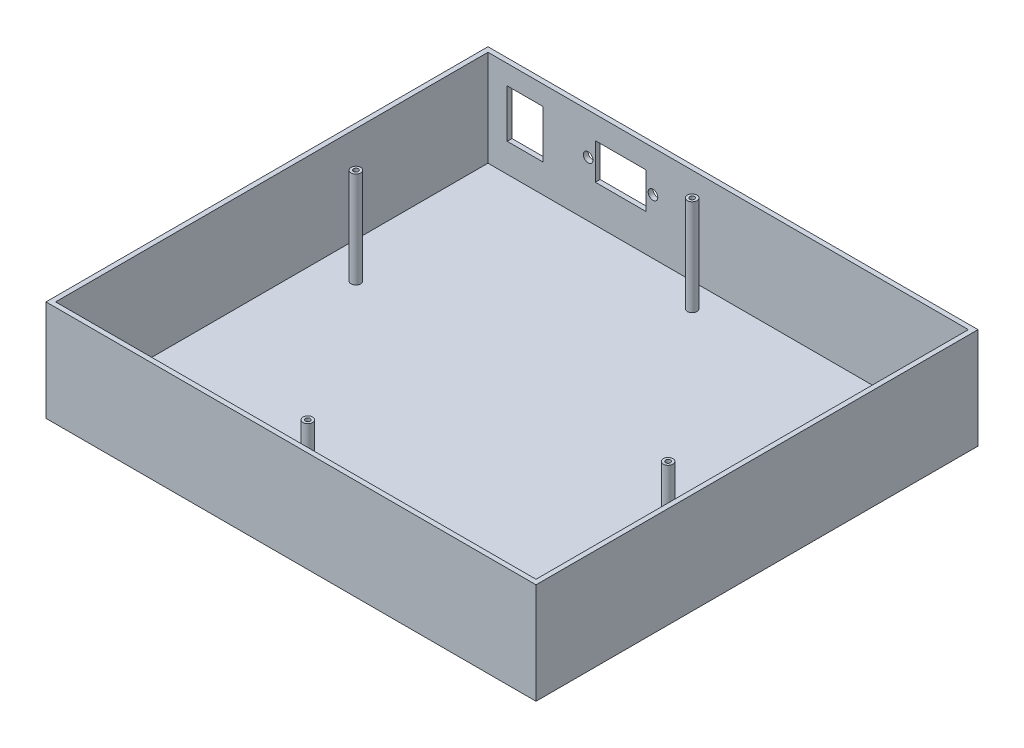
from build123d import *

# Parameters (mm, degrees)
SKETCH4_W           = 200
SKETCH4_H           = 180
BOSS_EXTRUDE3_DEPTH = 2
SKETCH4_3_W         = 204
SKETCH4_3_H         = 184
SKETCH4_3_W_2       = 200
SKETCH4_3_H_2       = 180
BOSS_EXTRUDE4_DEPTH = 42
SKETCH6_R           = 2
BOSS_EXTRUDE5_DEPTH = 40
SKETCH8_R           = 1
CUT_EXTRUDE1_DEPTH  = 40
SKETCH5_R           = 2
SKETCH5_W           = 15
SKETCH5_H           = 20
SKETCH5_W_2         = 21
SKETCH5_H_2         = 15
CUT_EXTRUDE2_DEPTH  = 2


with BuildPart() as part:
    # Sketch4 → Boss-Extrude3 (new body)
    with BuildSketch(Plane(origin=(0, 0, 0), x_dir=(1, 0, 0), z_dir=(0, 1, 0))):
        Rectangle(SKETCH4_W, SKETCH4_H)
    extrude(amount=BOSS_EXTRUDE3_DEPTH)

    # Sketch4<3> → Boss-Extrude4 (add)
    with BuildSketch(Plane(origin=(0, 0, 0), x_dir=(1, 0, 0), z_dir=(0, 1, 0))):
        Rectangle(SKETCH4_3_W, SKETCH4_3_H)
        Rectangle(SKETCH4_3_W_2, SKETCH4_3_H_2, mode=Mode.SUBTRACT)
    extrude(amount=BOSS_EXTRUDE4_DEPTH)

    # Sketch6 → Boss-Extrude5 (add)
    with BuildSketch(Plane(origin=(0, 2, 0), x_dir=(1, 0, 0), z_dir=(0, 1, 0))):
        with Locations((-5, -80)):
            Circle(SKETCH6_R)
        with Locations((-5, 80)):
            Circle(SKETCH6_R)
        with Locations((85, -20)):
            Circle(SKETCH6_R)
        with Locations((-85, 20)):
            Circle(SKETCH6_R)
    extrude(amount=BOSS_EXTRUDE5_DEPTH)

    # Sketch8 → Cut-Extrude1 (cut)
    with BuildSketch(Plane(origin=(0, 42, 0), x_dir=(1, 0, 0), z_dir=(0, 1, 0))):
        with Locations((-5, 80)):
            Circle(SKETCH8_R)
        with Locations((85, -20)):
            Circle(SKETCH8_R)
        with Locations((-5, -80)):
            Circle(SKETCH8_R)
        with Locations((-85, 20)):
            Circle(SKETCH8_R)
    extrude(amount=-CUT_EXTRUDE1_DEPTH, mode=Mode.SUBTRACT)

    # Sketch5 → Cut-Extrude2 (cut)
    with BuildSketch(Plane(origin=(0, 0, -92), x_dir=(-1, 0, 0), z_dir=(0, 0, -1))):
        with Locations((58.311430335, 24.978671474)):
            Circle(SKETCH5_R)
        with Locations((31.311430335, 24.978671474)):
            Circle(SKETCH5_R)
        with Locations((84.5, 23.893749762)):
            Rectangle(SKETCH5_W, SKETCH5_H)
        with Locations((44.811430335, 24.978671474)):
            Rectangle(SKETCH5_W_2, SKETCH5_H_2)
    extrude(amount=-CUT_EXTRUDE2_DEPTH, mode=Mode.SUBTRACT)


solid = part.part
